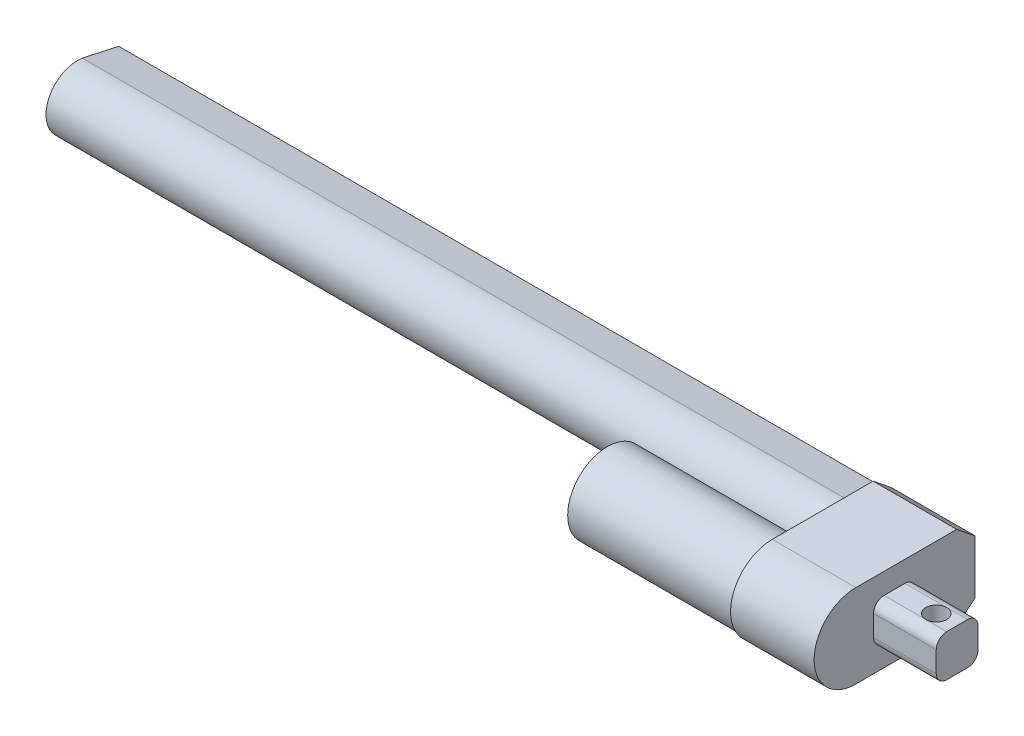
from build123d import *

# Parameters (mm, degrees)
SALIENTE_EXTRUIR2_DEPTH = 370
CROQUIS3_R              = 10
CORTAR_EXTRUIR1_DEPTH   = 360
SALIENTE_EXTRUIR3_DEPTH = 40
SALIENTE_EXTRUIR4_DEPTH = 30
CORTAR_EXTRUIR2_REACH   = 449.693
CROQUIS6_R              = 5
CROQUIS7_R              = 19
SALIENTE_EXTRUIR5_DEPTH = 79


with BuildPart() as part:
    # Croquis2 → Saliente-Extruir2 (new body)
    with BuildSketch(Plane(origin=(0, 0, 0), x_dir=(0, 0, -1), z_dir=(1, 0, 0))):
        with BuildLine():
            Line((0, 0), (0, -22))
            Line((0, -22), (-17.417233251, -25.803951615))
            ThreePointArc((-17.417233251, -25.803951615), (-34.834466503, -11), (-17.417233251, 3.803951615))
            Line((-17.417233251, 3.803951615), (0, 0))
        make_face()
    extrude(amount=SALIENTE_EXTRUIR2_DEPTH)

    # Croquis3 → Cortar-Extruir1 (cut)
    with BuildSketch(Plane.ZY):
        with Locations((19.82, -11)):
            Circle(CROQUIS3_R)
    extrude(amount=-CORTAR_EXTRUIR1_DEPTH, mode=Mode.SUBTRACT)

    # Croquis4 → Saliente-Extruir3 (add)
    with BuildSketch(Plane(origin=(370, 0, 0), x_dir=(0, 0, -1), z_dir=(1, 0, 0))):
        with BuildLine():
            Line((0, -11), (0, 2))
            Line((0, 2), (-8.708616626, 9))
            Line((-8.708616626, 9), (-57, 9))
            ThreePointArc((-57, 9), (-77, -11), (-57, -31))
            Line((-57, -31), (-8.708616626, -31))
            Line((-8.708616626, -31), (0, -24))
            Line((0, -24), (0, -11))
        make_face()
    extrude(amount=SALIENTE_EXTRUIR3_DEPTH)

    # Croquis5 → Saliente-Extruir4 (add)
    with BuildSketch(Plane(origin=(410, 0, 0), x_dir=(0, 0, -1), z_dir=(1, 0, 0))):
        with BuildLine():
            Line((-43.5, -1), (-33.5, -1))
            ThreePointArc((-33.5, -1), (-29.964466094, -2.464466094), (-28.5, -6))
            Line((-28.5, -6), (-28.5, -16))
            ThreePointArc((-28.5, -16), (-29.964466094, -19.535533906), (-33.5, -21))
            Line((-33.5, -21), (-43.5, -21))
            ThreePointArc((-43.5, -21), (-47.035533906, -19.535533906), (-48.5, -16))
            Line((-48.5, -16), (-48.5, -6))
            ThreePointArc((-48.5, -6), (-47.035533906, -2.464466094), (-43.5, -1))
        make_face()
    extrude(amount=SALIENTE_EXTRUIR4_DEPTH)

    # Croquis6 → Cortar-Extruir2 (cut, up to next)
    with BuildSketch(Plane(origin=(0, -1, 0), x_dir=(1, 0, 0), z_dir=(0, 1, 0)), mode=Mode.PRIVATE) as cortar_extruir2_sk1:
        with Locations(Location((430, -38.5, 0), (0, 0, 270))):
            Circle(CROQUIS6_R)
    cortar_extruir2_tool1 = extrude(cortar_extruir2_sk1.sketch, amount=-CORTAR_EXTRUIR2_REACH, mode=Mode.PRIVATE) & part.part
    add(cortar_extruir2_tool1.solids().sort_by_distance((430, -1, 38.5))[0], mode=Mode.SUBTRACT)

    # Croquis7 → Saliente-Extruir5 (add)
    with BuildSketch(Plane.ZY.offset(-370)):
        with Locations(Location((57, -11, 0), (0, 0, 180))):
            Circle(CROQUIS7_R)
    extrude(amount=SALIENTE_EXTRUIR5_DEPTH)


solid = part.part
